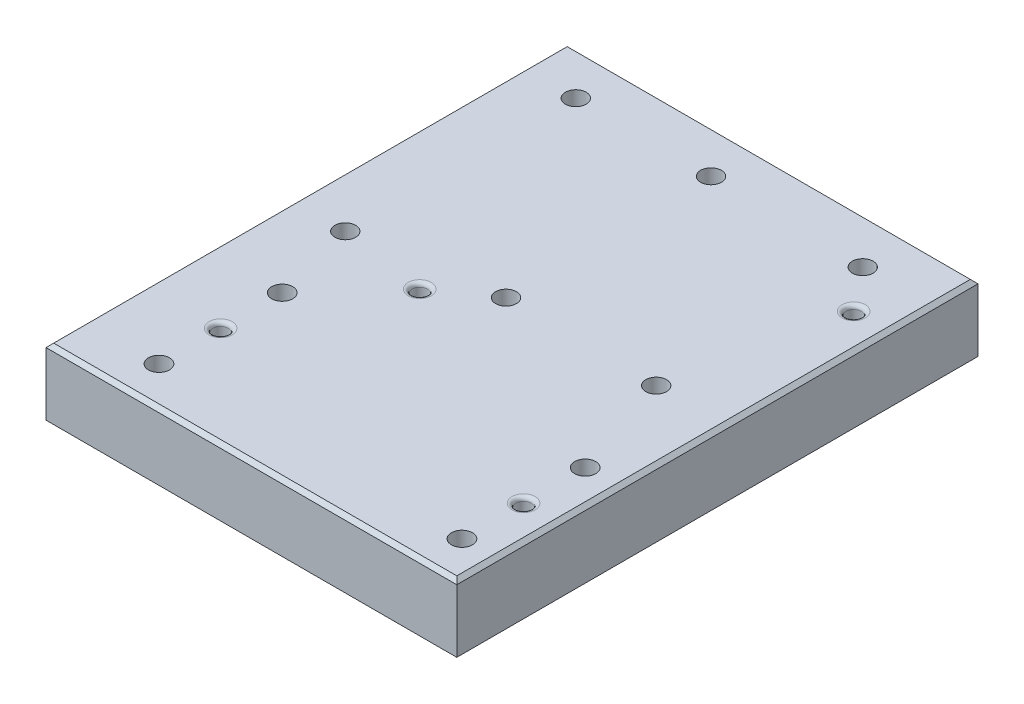
from build123d import *

# Parameters (mm, degrees)
SKETCH1_W           = 160
SKETCH1_H           = 203
SKETCH1_R           = 4.05
SKETCH1_R_2         = 4.1
SKETCH1_R_3         = 3
BOSS_EXTRUDE1_DEPTH = 26
FILLET1_R           = 1.5
CHAMFER1_SIZE       = 1.5


with BuildPart() as part:
    # Sketch1 → Boss-Extrude1 (new body)
    with BuildSketch(Plane(origin=(0, 0, 0), x_dir=(1, 0, 0), z_dir=(0, 1, 0))):
        with Locations((80.434245342, 28.5)):
            Rectangle(SKETCH1_W, SKETCH1_H)
        with Locations(Location((73.68, 112.78, 0), (0, 0, 90))):
            Circle(SKETCH1_R, mode=Mode.SUBTRACT)
        with Locations(Location((133.87, 111.67, 0), (0, 0, 90))):
            Circle(SKETCH1_R, mode=Mode.SUBTRACT)
        with Locations(Location((133.61, 31.48, 0), (0, 0, 90))):
            Circle(SKETCH1_R, mode=Mode.SUBTRACT)
        with Locations(Location((74.69, 31.92, 0), (0, 0, 90))):
            Circle(SKETCH1_R, mode=Mode.SUBTRACT)
        with Locations(Location((29.434245342, -10, 0), (0, 0, 90))):
            Circle(SKETCH1_R_2, mode=Mode.SUBTRACT)
        with Locations(Location((29.434245342, -58, 0), (0, 0, 90))):
            Circle(SKETCH1_R_2, mode=Mode.SUBTRACT)
        with Locations(Location((21, 112.78, 0), (0, 0, 90))):
            Circle(SKETCH1_R, mode=Mode.SUBTRACT)
        with Locations(Location((147.434245342, -58, 0), (0, 0, 90))):
            Circle(SKETCH1_R_2, mode=Mode.SUBTRACT)
        with Locations(Location((147.434245342, -10, 0), (0, 0, 90))):
            Circle(SKETCH1_R_2, mode=Mode.SUBTRACT)
        with Locations(Location((21, 23, 0), (0, 0, 90))):
            Circle(SKETCH1_R, mode=Mode.SUBTRACT)
        with Locations(Location((29.434245342, -34, 0), (0, 0, 90))):
            Circle(SKETCH1_R_3, mode=Mode.SUBTRACT)
        with Locations(Location((147.434245342, -34, 0), (0, 0, 90))):
            Circle(SKETCH1_R_3, mode=Mode.SUBTRACT)
        with Locations(Location((147, 95, 0), (0, 0, 90))):
            Circle(SKETCH1_R_3, mode=Mode.SUBTRACT)
        with Locations(Location((55, 18, 0), (0, 0, 90))):
            Circle(SKETCH1_R_3, mode=Mode.SUBTRACT)
    extrude(amount=BOSS_EXTRUDE1_DEPTH)

    # Fillet1
    fillet1_edges = [part.edges().sort_by_distance(p)[0] for p in [
        (29.434245342, 26, 37),
        (147.434245342, 26, 37),
        (147, 26, -92),
        (55, 26, -15),
    ]]
    fillet(fillet1_edges, radius=FILLET1_R)

    # Chamfer1
    chamfer1_edges = [part.edges().sort_by_distance(p)[0] for p in [
        (0.434245342, 26, -28.5),
        (80.434245342, 26, 73),
        (160.434245342, 26, -28.5),
        (80.434245342, 26, -130),
    ]]
    chamfer(chamfer1_edges, length=CHAMFER1_SIZE)


solid = part.part
